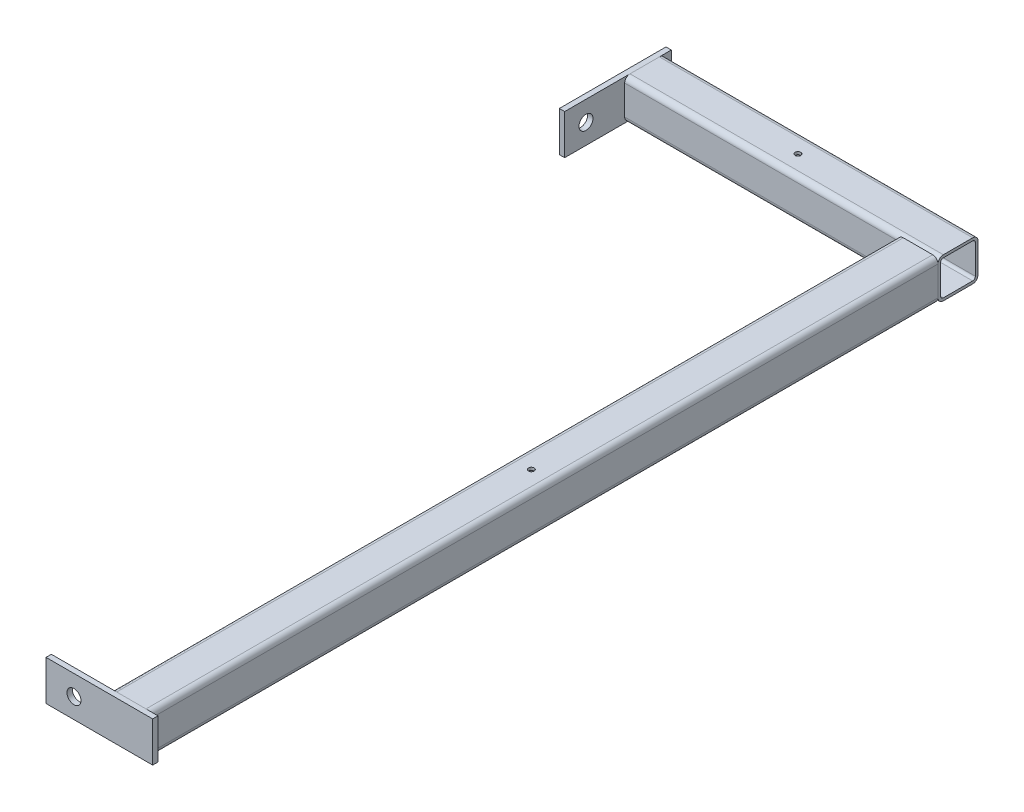
from build123d import *

# Parameters (mm, degrees)
SQUARE_TUBE_CONFIGURED_30_X_30_X_2_DEPTH   = 235
SQUARE_TUBE_CONFIGURED_30_X_30_X_2_2_DEPTH = 606
SKETCH11_W                                 = 4
SKETCH11_H                                 = 30
METAL_BAR_30_X_4_DEPTH                     = 80
SKETCH14_W                                 = 4
SKETCH14_H                                 = 30
METAL_BAR_30_X_4_2_DEPTH                   = 80
SKETCH16_W                                 = 5.25
SKETCH16_H                                 = 211
SKETCH16_AT_POINT_2_W                      = 5.25
SKETCH16_AT_POINT_2_H                      = 211
SKETCH18_W                                 = 2.1
SKETCH18_H                                 = 30
F_4_2_4_2_TABLE_MOUNT_HOLES_AT_2_COUNT     = 2
F_4_2_4_2_TABLE_MOUNT_HOLES_AT_2_PITCH     = 322.567822326


with BuildPart() as part:
    # Sketch1 → Square tube - configured 30 X 30 X 2 (new body)
    with BuildSketch(Plane(origin=(0, 0, 0), x_dir=(0, 0, -1), z_dir=(1, 0, 0))):
        with BuildLine():
            Line((-11, -15), (11, -15))
            ThreePointArc((11, -15), (13.828427125, -13.828427125), (15, -11))
            Line((15, -11), (15, 11))
            ThreePointArc((15, 11), (13.828427125, 13.828427125), (11, 15))
            Line((11, 15), (-11, 15))
            ThreePointArc((-11, 15), (-13.828427125, 13.828427125), (-15, 11))
            Line((-15, 11), (-15, -11))
            ThreePointArc((-15, -11), (-13.828427125, -13.828427125), (-11, -15))
        make_face()
        with BuildLine():
            Line((-11, -13), (11, -13))
            ThreePointArc((11, -13), (12.414213562, -12.414213562), (13, -11))
            Line((13, -11), (13, 11))
            ThreePointArc((13, 11), (12.414213562, 12.414213562), (11, 13))
            Line((11, 13), (-11, 13))
            ThreePointArc((-11, 13), (-12.414213562, 12.414213562), (-13, 11))
            Line((-13, 11), (-13, -11))
            ThreePointArc((-13, -11), (-12.414213562, -12.414213562), (-11, -13))
        make_face(mode=Mode.SUBTRACT)
    extrude(amount=SQUARE_TUBE_CONFIGURED_30_X_30_X_2_DEPTH)

    # Sketch18 → Ø4.2 (4.2) Table Mount Holes (revolve, cut)
    with BuildSketch(Plane(origin=(115, 15, 0), x_dir=(0, 0, 1), z_dir=(1, 0, 0))):
        with Locations((1.05, 15)):
            Rectangle(SKETCH18_W, SKETCH18_H)
    f_4_2_4_2_table_mount_holes = revolve(axis=Axis((115, 21.35, 0), (0, -1, 0)), mode=Mode.SUBTRACT)


with BuildPart() as body_2:
    # Sketch1 on segment 2 (carried to segment 2) → Square tube - configured 30 X 30 X 2 2 (new body)
    with BuildSketch(Plane(origin=(220, 0, -1), x_dir=(1, 0, 0), z_dir=(0, 0, 1))):
        with BuildLine():
            Line((-11, -15), (11, -15))
            ThreePointArc((11, -15), (13.828427125, -13.828427125), (15, -11))
            Line((15, -11), (15, 11))
            ThreePointArc((15, 11), (13.828427125, 13.828427125), (11, 15))
            Line((11, 15), (-11, 15))
            ThreePointArc((-11, 15), (-13.828427125, 13.828427125), (-15, 11))
            Line((-15, 11), (-15, -11))
            ThreePointArc((-15, -11), (-13.828427125, -13.828427125), (-11, -15))
        make_face()
        with BuildLine():
            Line((-11, -13), (11, -13))
            ThreePointArc((11, -13), (12.414213562, -12.414213562), (13, -11))
            Line((13, -11), (13, 11))
            ThreePointArc((13, 11), (12.414213562, 12.414213562), (11, 13))
            Line((11, 13), (-11, 13))
            ThreePointArc((-11, 13), (-12.414213562, 12.414213562), (-13, 11))
            Line((-13, 11), (-13, -11))
            ThreePointArc((-13, -11), (-12.414213562, -12.414213562), (-11, -13))
        make_face(mode=Mode.SUBTRACT)
    extrude(amount=SQUARE_TUBE_CONFIGURED_30_X_30_X_2_2_DEPTH)

    # Square tube - configured 30 X 30 X 2 2 e
    split(bisect_by=Plane(origin=(220, 0, 15), x_dir=(0, -1, 0), z_dir=(0, 0, 1)), keep=Keep.TOP)

    # Ø4.2 (4.2) Table Mount Holes at 2: Ø4.2 (4.2) Table Mount Holes ×2
    with Locations(*[Vector(0.3255129393965166, 0, 0.9455375858660722) * (i * F_4_2_4_2_TABLE_MOUNT_HOLES_AT_2_PITCH) for i in range(1, F_4_2_4_2_TABLE_MOUNT_HOLES_AT_2_COUNT)]):
        add(f_4_2_4_2_table_mount_holes, mode=Mode.SUBTRACT)


with BuildPart() as body_3:
    # Sketch11 → Metal bar 30 X 4 (new body)
    with BuildSketch(Plane(origin=(0, 0, 60), x_dir=(1, 0, 0), z_dir=(0, 0, -1))):
        with Locations((-2, 0)):
            Rectangle(SKETCH11_W, SKETCH11_H)
    extrude(amount=METAL_BAR_30_X_4_DEPTH)

    # Sketch16 → Ø10.5 (10.5) Main Frame Mount Holes (revolve, cut)
    with BuildSketch(Plane(origin=(-4, 0, 44), x_dir=(0, 0, 1), z_dir=(0, 1, 0))):
        with Locations((2.625, 105.5)):
            Rectangle(SKETCH16_W, SKETCH16_H)
    revolve(axis=Axis((-10.35, 0, 44), (1, 0, 0)), mode=Mode.SUBTRACT)


with BuildPart() as body_4:
    # Sketch14 → Metal bar 30 X 4(2) (new body)
    with BuildSketch(Plane(origin=(160, 0, 605), x_dir=(0, 0, -1), z_dir=(1, 0, 0))):
        with Locations((-2, 0)):
            Rectangle(SKETCH14_W, SKETCH14_H)
    extrude(amount=METAL_BAR_30_X_4_2_DEPTH)

    # Sketch16 at point 2 (carried to point 2, square into its face) → Ø10.5 (10.5) Main Frame Mount Holes at 2 (revolve, cut)
    with BuildSketch(Plane(origin=(181, 0, 609), x_dir=(1, 0, 0), z_dir=(0, 1, 0))):
        with Locations((2.625, 105.5)):
            Rectangle(SKETCH16_AT_POINT_2_W, SKETCH16_AT_POINT_2_H)
    revolve(axis=Axis((181, 0, 615.35), (0, 0, -1)), mode=Mode.SUBTRACT)


solid = Compound([part.part, body_2.part, body_3.part, body_4.part])
